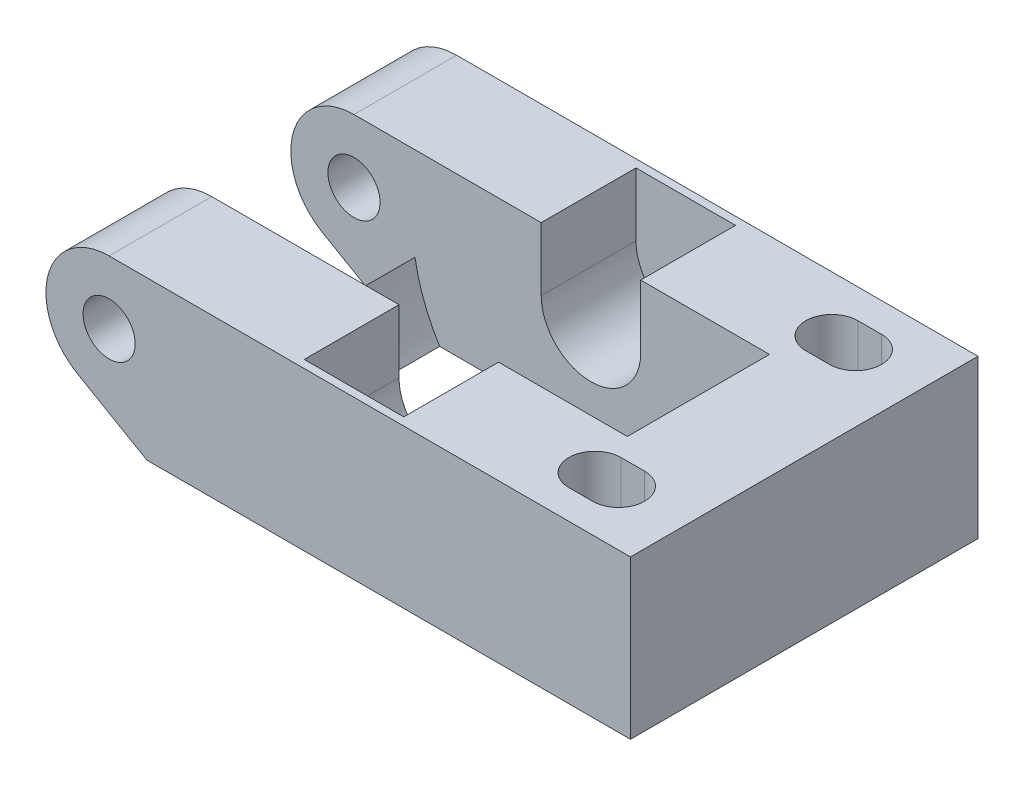
from build123d import *

# Parameters (mm, degrees)
SKETCH1_R               = 1.65
BOSS_EXTRUDE1_DEPTH     = 22
CUT_EXTRUDE1_DEPTH      = 4.5
CUT_EXTRUDE1_DEPTH_BACK = 4.5
CUT_EXTRUDE3_DEPTH      = 10.5
CUT_EXTRUDE3_DEPTH_BACK = 10.5
CUT_EXTRUDE2_DEPTH      = 31.740852298


with BuildPart() as part:
    # Sketch1 → Boss-Extrude1 (new body)
    with BuildSketch(Plane.XY):
        with BuildLine():
            Line((-17, -3.464101615), (-12.607695155, -6))
            Line((-12.607695155, -6), (18, -6))
            Line((18, -6), (18, 4))
            Line((18, 4), (-15, 4))
            ThreePointArc((-15, 4), (-18.863703305, 1.03527618), (-17, -3.464101615))
        make_face()
        with Locations((-15, 0)):
            Circle(SKETCH1_R, mode=Mode.SUBTRACT)
    extrude(amount=BOSS_EXTRUDE1_DEPTH)

    # Sketch2 → Cut-Extrude1 (cut, two sides: drawn at the far end of the back side and taken through both)
    with BuildSketch(Plane.XY.offset(11).offset(-CUT_EXTRUDE1_DEPTH_BACK)):
        with BuildLine():
            Line((-11.706008895, -2.763986722), (-19.3, -11.814152904))
            Line((-19.3, -11.814152904), (-19.3, 11.3))
            Line((-19.3, 11.3), (11.3, 11.3))
            Line((11.3, 11.3), (11.3, 0))
            ThreePointArc((11.3, 0), (0.950789146, -11.259928952), (-11.14, -1.894835085))
            ThreePointArc((-11.14, -1.894835085), (-11.396702437, -2.346539297), (-11.706008895, -2.763986722))
        make_face()
    extrude(amount=CUT_EXTRUDE1_DEPTH + CUT_EXTRUDE1_DEPTH_BACK, mode=Mode.SUBTRACT)

    # Sketch4 → Cut-Extrude3 (cut, two sides: drawn at the far end of the back side and taken through both)
    with BuildSketch(Plane.XY.offset(11).offset(-CUT_EXTRUDE3_DEPTH_BACK)):
        with BuildLine():
            Line((-3.15, 0), (-3.15, 6.453034263))
            Line((-3.15, 6.453034263), (3.15, 6.453034263))
            Line((3.15, 6.453034263), (3.15, 0))
            ThreePointArc((3.15, 0), (0, -3.15), (-3.15, 0))
        make_face()
    extrude(amount=CUT_EXTRUDE3_DEPTH + CUT_EXTRUDE3_DEPTH_BACK, mode=Mode.SUBTRACT)

    # Sketch3 → Cut-Extrude2 (cut, through all)
    with BuildSketch(Plane.XZ.offset(6)):
        with BuildLine():
            Line((13.75, 16.85), (12.25, 16.85))
            ThreePointArc((12.25, 16.85), (10.6, 18.5), (12.25, 20.15))
            Line((12.25, 20.15), (13.75, 20.15))
            ThreePointArc((13.75, 20.15), (15.4, 18.5), (13.75, 16.85))
        make_face()
        with BuildLine():
            Line((13.75, 5.15), (12.25, 5.15))
            ThreePointArc((12.25, 5.15), (10.6, 3.5), (12.25, 1.85))
            Line((12.25, 1.85), (13.75, 1.85))
            ThreePointArc((13.75, 1.85), (15.4, 3.5), (13.75, 5.15))
        make_face()
    extrude(amount=-CUT_EXTRUDE2_DEPTH, mode=Mode.SUBTRACT)


solid = part.part
